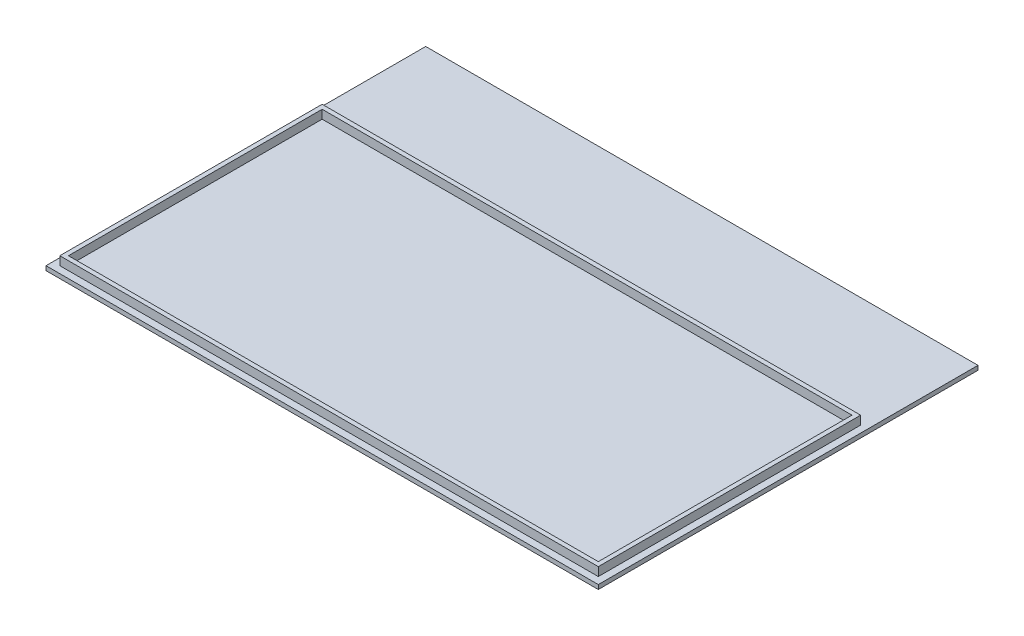
from build123d import *

# Parameters (mm, degrees)
SKETCH1_W           = 203.2
SKETCH1_H           = 101.6
BOSS_EXTRUDE1_DEPTH = 1.5875
SKETCH2_W           = 198.12
SKETCH2_H           = 96.52
BOSS_EXTRUDE2_DEPTH = 3.175
SKETCH3_W           = 194.945
SKETCH3_H           = 93.345
CUT_EXTRUDE1_DEPTH  = 3.175
SKETCH5_W           = 203.2
SKETCH5_H           = 1.5875
BOSS_EXTRUDE3_DEPTH = 38.1


with BuildPart() as part:
    # Sketch1 → Boss-Extrude1 (new body)
    with BuildSketch(Plane(origin=(0, 0, 0), x_dir=(1, 0, 0), z_dir=(0, 1, 0))):
        Rectangle(SKETCH1_W, SKETCH1_H)
    extrude(amount=BOSS_EXTRUDE1_DEPTH)

    # Sketch2 → Boss-Extrude2 (add)
    with BuildSketch(Plane(origin=(0, 1.5875, 0), x_dir=(1, 0, 0), z_dir=(0, 1, 0))):
        Rectangle(SKETCH2_W, SKETCH2_H)
    extrude(amount=BOSS_EXTRUDE2_DEPTH)

    # Sketch3 → Cut-Extrude1 (cut)
    with BuildSketch(Plane(origin=(0, 4.7625, 0), x_dir=(1, 0, 0), z_dir=(0, 1, 0))):
        Rectangle(SKETCH3_W, SKETCH3_H)
    extrude(amount=-CUT_EXTRUDE1_DEPTH, mode=Mode.SUBTRACT)

    # Sketch5 → Boss-Extrude3 (add)
    with BuildSketch(Plane(origin=(0, 0, -50.8), x_dir=(-1, 0, 0), z_dir=(0, 0, -1))):
        with Locations((0, 0.79375)):
            Rectangle(SKETCH5_W, SKETCH5_H)
    extrude(amount=BOSS_EXTRUDE3_DEPTH)


solid = part.part
